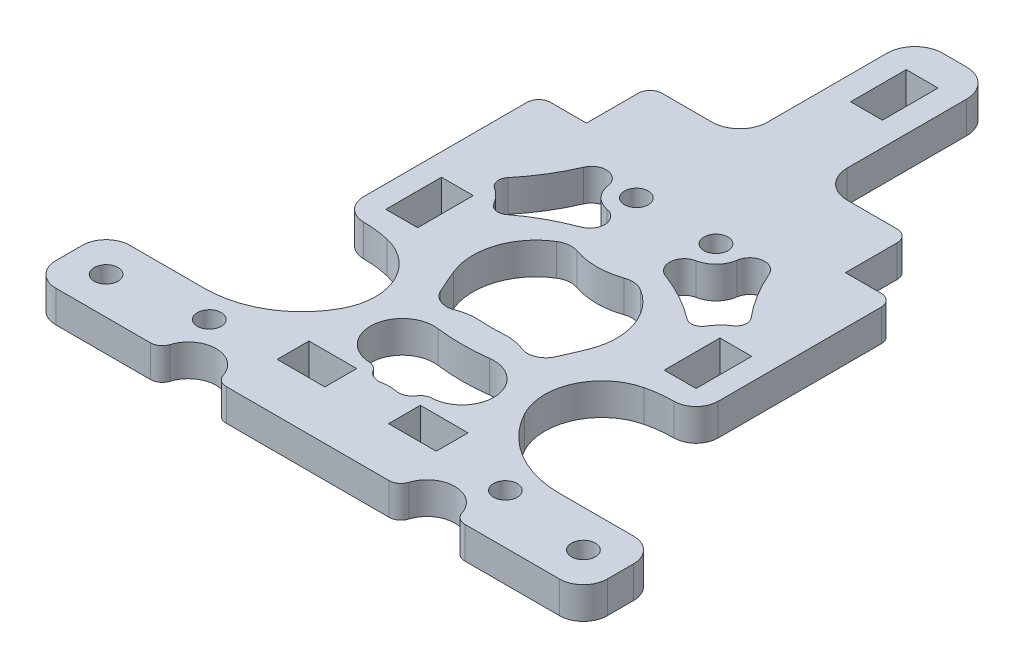
from build123d import *

# Parameters (mm, degrees)
ESQUISSE1_R             = 1.5
ESQUISSE1_W             = 4
ESQUISSE1_H             = 7
ESQUISSE1_W_2           = 6
ESQUISSE1_H_2           = 4
BOSS_EXTRU_1_DEPTH      = 4
ENL_V_MAT_EXTRU_1_REACH = 59.99
ENL_V_MAT_EXTRU_2_REACH = 59.99
ENL_V_MAT_EXTRU_3_REACH = 59.99
CONG_1_R                = 3.5
CONG_2_R                = 3.5
CONG_3_R                = 1.5
ENL_V_MAT_EXTRU_4_REACH = 59.99
CONG_4_R                = 3
CONG_5_R                = 3
ENL_V_MAT_EXTRU_5_REACH = 59.99
ESQUISSE8_R             = 3.5
CONG_6_R                = 1.5
ENL_V_MAT_EXTRU_6_REACH = 59.99
ESQUISSE9_R             = 1.5


with BuildPart() as part:
    # Esquisse1 → Boss.-Extru.1 (new body)
    with BuildSketch(Plane(origin=(0, 0, 0), x_dir=(1, 0, 0), z_dir=(0, 1, 0))):
        Polygon((-20.28, 5), (-22.28, 5), (-22.28, -37), (-34.66, -37), (-34.66, -46.32), (34.66, -46.32), (34.66, -37), (22.28, -37), (22.28, 5), (20.28, 5), (16.28, 5), (16.28, 13), (5, 13), (5, 35), (-5, 35), (-5, 13), (-16.28, 13), (-16.28, 5), align=None)
        with Locations(Location((-5, 0, 0), (0, 0, 270))):
            Circle(ESQUISSE1_R, mode=Mode.SUBTRACT)
        with Locations(Location((5, 0, 0), (0, 0, 90))):
            Circle(ESQUISSE1_R, mode=Mode.SUBTRACT)
        with Locations(Location((-30, -41.66, 0), (0, 0, 270))):
            Circle(ESQUISSE1_R, mode=Mode.SUBTRACT)
        with Locations(Location((30, -41.66, 0), (0, 0, 90))):
            Circle(ESQUISSE1_R, mode=Mode.SUBTRACT)
        with Locations((0, 27.42)):
            Rectangle(ESQUISSE1_W, ESQUISSE1_H, mode=Mode.SUBTRACT)
        with Locations((-17.5, -13.5)):
            Rectangle(ESQUISSE1_W, ESQUISSE1_H, mode=Mode.SUBTRACT)
        with Locations((-7, -38.16)):
            Rectangle(ESQUISSE1_W_2, ESQUISSE1_H_2, mode=Mode.SUBTRACT)
        with Locations((7, -38.16)):
            Rectangle(ESQUISSE1_W_2, ESQUISSE1_H_2, mode=Mode.SUBTRACT)
        with Locations((17.5, -13.5)):
            Rectangle(ESQUISSE1_W, ESQUISSE1_H, mode=Mode.SUBTRACT)
    extrude(amount=BOSS_EXTRU_1_DEPTH)

    # Esquisse2 → Enlèv. mat.-Extru.1 (cut, up to next)
    with BuildSketch(Plane(origin=(0, 4, 0), x_dir=(1, 0, 0), z_dir=(0, 1, 0)), mode=Mode.PRIVATE) as enl_v_mat_extru_1_sk1:
        with BuildLine():
            ThreePointArc((-14.9974668, -7.843519448), (-14.058937243, -8.627559279), (-13.321584394, -9.603195975))
            ThreePointArc((-13.321584394, -9.603195975), (-12.428040198, -10.235555734), (-11.361521034, -9.988904221))
            ThreePointArc((-11.361521034, -9.988904221), (-8.447920047, -8.097394436), (-5.290042477, -6.650090308))
            ThreePointArc((-5.290042477, -6.650090308), (-4.088898303, -4.755535803), (-5.589901119, -3.088480121))
            ThreePointArc((-5.589901119, -3.088480121), (-7.276914991, -2.168490468), (-8.113566287, -0.438631695))
            ThreePointArc((-8.113566287, -0.438631695), (-9.70546362, 1.141857781), (-11.656322949, 0.034504187))
            ThreePointArc((-11.656322949, 0.034504187), (-13.25585737, -3.049060247), (-15.287160414, -5.866982872))
            ThreePointArc((-15.287160414, -5.866982872), (-15.585513038, -6.920209252), (-14.9974668, -7.843519448))
        make_face()
    enl_v_mat_extru_1_tool1 = extrude(enl_v_mat_extru_1_sk1.sketch, amount=-ENL_V_MAT_EXTRU_1_REACH, mode=Mode.PRIVATE) & part.part
    # Esquisse2 → Enlèv. mat.-Extru.1 (cut, up to next)
    with BuildSketch(Plane(origin=(0, 4, 0), x_dir=(1, 0, 0), z_dir=(0, 1, 0)), mode=Mode.PRIVATE) as enl_v_mat_extru_1_sk2:
        with BuildLine():
            ThreePointArc((5.589901119, -3.088480121), (4.088898303, -4.755535803), (5.290042477, -6.650090308))
            ThreePointArc((5.290042477, -6.650090308), (8.447920047, -8.097394436), (11.361521034, -9.988904221))
            ThreePointArc((11.361521034, -9.988904221), (12.428040198, -10.235555734), (13.321584394, -9.603195975))
            ThreePointArc((13.321584394, -9.603195975), (14.058937243, -8.627559279), (14.9974668, -7.843519448))
            ThreePointArc((14.9974668, -7.843519448), (15.585513038, -6.920209252), (15.287160414, -5.866982872))
            ThreePointArc((15.287160414, -5.866982872), (13.25585737, -3.049060247), (11.656322949, 0.034504187))
            ThreePointArc((11.656322949, 0.034504187), (9.70546362, 1.141857781), (8.113566287, -0.438631695))
            ThreePointArc((8.113566287, -0.438631695), (7.276914991, -2.168490468), (5.589901119, -3.088480121))
        make_face()
    enl_v_mat_extru_1_tool2 = extrude(enl_v_mat_extru_1_sk2.sketch, amount=-ENL_V_MAT_EXTRU_1_REACH, mode=Mode.PRIVATE) & part.part
    add(enl_v_mat_extru_1_tool1.solids().sort_by_distance((-10.104676, 4, 4.861596))[0], mode=Mode.SUBTRACT)
    add(enl_v_mat_extru_1_tool2.solids().sort_by_distance((10.104676, 4, 4.861596))[0], mode=Mode.SUBTRACT)

    # Esquisse3 → Enlèv. mat.-Extru.2 (cut, up to next)
    with BuildSketch(Plane(origin=(0, 4, 0), x_dir=(1, 0, 0), z_dir=(0, 1, 0)), mode=Mode.PRIVATE) as enl_v_mat_extru_2_sk1:
        with BuildLine():
            ThreePointArc((-3.934570919, -34.661427668), (-3.25, -34.860961894), (-2.734912831, -35.354050587))
            ThreePointArc((-2.734912831, -35.354050587), (-1.93927123, -36.028172694), (-0.901821799, -36.133931151))
            ThreePointArc((-0.901821799, -36.133931151), (0, -36.043871504), (0.901821799, -36.133931151))
            ThreePointArc((0.901821799, -36.133931151), (1.93927123, -36.028172694), (2.734912831, -35.354050587))
            ThreePointArc((2.734912831, -35.354050587), (3.25, -34.860961894), (3.934570919, -34.661427668))
            ThreePointArc((3.934570919, -34.661427668), (7.745395438, -30.322645486), (3.25, -26.697892503))
            ThreePointArc((3.25, -26.697892503), (0, -26.90596734), (-3.25, -26.697892503))
            ThreePointArc((-3.25, -26.697892503), (-7.745395438, -30.322645486), (-3.934570919, -34.661427668))
        make_face()
    enl_v_mat_extru_2_tool1 = extrude(enl_v_mat_extru_2_sk1.sketch, amount=-ENL_V_MAT_EXTRU_2_REACH, mode=Mode.PRIVATE) & part.part
    add(enl_v_mat_extru_2_tool1.solids().sort_by_distance((0, 4, 31.014004))[0], mode=Mode.SUBTRACT)

    # Esquisse4 → Enlèv. mat.-Extru.3 (cut, up to next)
    with BuildSketch(Plane(origin=(0, 4, 0), x_dir=(1, 0, 0), z_dir=(0, 1, 0)), mode=Mode.PRIVATE) as enl_v_mat_extru_3_sk1:
        with BuildLine():
            ThreePointArc((-1.504993876, -23.185356229), (0, -23.237327603), (1.504993876, -23.185356229))
            ThreePointArc((1.504993876, -23.185356229), (2.895700447, -23.245383622), (4.238200501, -23.613298912))
            ThreePointArc((4.238200501, -23.613298912), (5.947114761, -23.612368685), (7.184676805, -22.433882792))
            ThreePointArc((7.184676805, -22.433882792), (7.833923694, -20.976940348), (8.452629907, -19.506768443))
            ThreePointArc((8.452629907, -19.506768443), (8.650133896, -14.04633429), (5.268411363, -9.754562897))
            ThreePointArc((5.268411363, -9.754562897), (4.141434744, -9.367776338), (2.957336552, -9.500409716))
            ThreePointArc((2.957336552, -9.500409716), (0, -9.996838884), (-2.957336552, -9.500409716))
            ThreePointArc((-2.957336552, -9.500409716), (-4.141434744, -9.367776338), (-5.268411363, -9.754562897))
            ThreePointArc((-5.268411363, -9.754562897), (-8.650133896, -14.04633429), (-8.452629907, -19.506768443))
            ThreePointArc((-8.452629907, -19.506768443), (-7.833923694, -20.976940348), (-7.184676805, -22.433882792))
            ThreePointArc((-7.184676805, -22.433882792), (-5.947114761, -23.612368685), (-4.238200501, -23.613298912))
            ThreePointArc((-4.238200501, -23.613298912), (-2.895700447, -23.245383622), (-1.504993876, -23.185356229))
        make_face()
    enl_v_mat_extru_3_tool1 = extrude(enl_v_mat_extru_3_sk1.sketch, amount=-ENL_V_MAT_EXTRU_3_REACH, mode=Mode.PRIVATE) & part.part
    add(enl_v_mat_extru_3_tool1.solids().sort_by_distance((0, 4, 16.621533))[0], mode=Mode.SUBTRACT)

    # Congé1
    cong_1_edges = [part.edges().sort_by_distance(p)[0] for p in [
        (-5, 2, -35),
        (5, 2, -35),
    ]]
    fillet(cong_1_edges, radius=CONG_1_R)

    # Congé2
    cong_2_edges = [part.edges().sort_by_distance(p)[0] for p in [
        (-5, 2, -13),
        (5, 2, -13),
    ]]
    fillet(cong_2_edges, radius=CONG_2_R)

    # Congé3
    cong_3_edges = [part.edges().sort_by_distance(p)[0] for p in [
        (22.28, 2, -5),
        (-22.28, 2, -5),
        (-16.28, 2, -13),
        (16.28, 2, -13),
    ]]
    fillet(cong_3_edges, radius=CONG_3_R)

    # Esquisse7 → Enlèv. mat.-Extru.4 (cut, up to next)
    with BuildSketch(Plane(origin=(0, 4, 0), x_dir=(1, 0, 0), z_dir=(0, 1, 0)), mode=Mode.PRIVATE) as enl_v_mat_extru_4_sk1:
        with BuildLine():
            Line((-22.28, -17), (-22.28, -37))
            ThreePointArc((-22.28, -37), (-16.000012961, -35.267986448), (-11.495708343, -30.561677059))
            ThreePointArc((-11.495708343, -30.561677059), (-11.263143502, -24.222708134), (-16.146891575, -20.174792843))
            ThreePointArc((-16.146891575, -20.174792843), (-17.81186512, -19.879037913), (-19.5, -19.78))
            ThreePointArc((-19.5, -19.78), (-21.465756852, -18.965756852), (-22.28, -17))
        make_face()
    enl_v_mat_extru_4_tool1 = extrude(enl_v_mat_extru_4_sk1.sketch, amount=-ENL_V_MAT_EXTRU_4_REACH, mode=Mode.PRIVATE) & part.part
    enl_v_mat_extru_4 = enl_v_mat_extru_4_tool1.solids().sort_by_distance((-17.328715, 4, 27.806477))[0]
    add(enl_v_mat_extru_4, mode=Mode.SUBTRACT)

    # Symétrie1: Enlèv. mat.-Extru.4 across plane
    add(enl_v_mat_extru_4.mirror(Plane(origin=(0, 0, 0), x_dir=(0, 0, 1), z_dir=(1, 0, 0))), mode=Mode.SUBTRACT)

    # Congé4
    cong_4_edges = [part.edges().sort_by_distance(p)[0] for p in [
        (-34.66, 2, 46.32),
        (-34.66, 2, 37),
    ]]
    fillet(cong_4_edges, radius=CONG_4_R)

    # Congé5
    cong_5_edges = [part.edges().sort_by_distance(p)[0] for p in [
        (34.66, 2, 37),
        (34.66, 2, 46.32),
    ]]
    fillet(cong_5_edges, radius=CONG_5_R)

    # Esquisse8 → Enlèv. mat.-Extru.5 (cut, up to next)
    with BuildSketch(Plane(origin=(0, 4, 0), x_dir=(1, 0, 0), z_dir=(0, 1, 0)), mode=Mode.PRIVATE) as enl_v_mat_extru_5_sk1:
        with Locations((-15, -46.32)):
            Circle(ESQUISSE8_R)
    enl_v_mat_extru_5_tool1 = extrude(enl_v_mat_extru_5_sk1.sketch, amount=-ENL_V_MAT_EXTRU_5_REACH, mode=Mode.PRIVATE) & part.part
    # Esquisse8 → Enlèv. mat.-Extru.5 (cut, up to next)
    with BuildSketch(Plane(origin=(0, 4, 0), x_dir=(1, 0, 0), z_dir=(0, 1, 0)), mode=Mode.PRIVATE) as enl_v_mat_extru_5_sk2:
        with Locations((15, -46.32)):
            Circle(ESQUISSE8_R)
    enl_v_mat_extru_5_tool2 = extrude(enl_v_mat_extru_5_sk2.sketch, amount=-ENL_V_MAT_EXTRU_5_REACH, mode=Mode.PRIVATE) & part.part
    add(enl_v_mat_extru_5_tool1.solids().sort_by_distance((-15, 4, 46.32))[0], mode=Mode.SUBTRACT)
    add(enl_v_mat_extru_5_tool2.solids().sort_by_distance((15, 4, 46.32))[0], mode=Mode.SUBTRACT)

    # Congé6
    cong_6_edges = [part.edges().sort_by_distance(p)[0] for p in [
        (-18.5, 2, 46.32),
        (-11.5, 2, 46.32),
        (11.5, 2, 46.32),
        (18.5, 2, 46.32),
    ]]
    fillet(cong_6_edges, radius=CONG_6_R)

    # Esquisse9 → Enlèv. mat.-Extru.6 (cut, up to next)
    with BuildSketch(Plane(origin=(0, 4, 0), x_dir=(1, 0, 0), z_dir=(0, 1, 0)), mode=Mode.PRIVATE) as enl_v_mat_extru_6_sk1:
        with Locations(Location((-18.609395269, -40.077557629, 0), (0, 0, 270))):
            Circle(ESQUISSE9_R)
    enl_v_mat_extru_6_tool1 = extrude(enl_v_mat_extru_6_sk1.sketch, amount=-ENL_V_MAT_EXTRU_6_REACH, mode=Mode.PRIVATE) & part.part
    enl_v_mat_extru_6 = enl_v_mat_extru_6_tool1.solids().sort_by_distance((-18.609395, 4, 40.077558))[0]
    add(enl_v_mat_extru_6, mode=Mode.SUBTRACT)

    # Symétrie2: Enlèv. mat.-Extru.6 across plane
    add(enl_v_mat_extru_6.mirror(Plane(origin=(0, 0, 0), x_dir=(0, 0, 1), z_dir=(1, 0, 0))), mode=Mode.SUBTRACT)


solid = part.part
